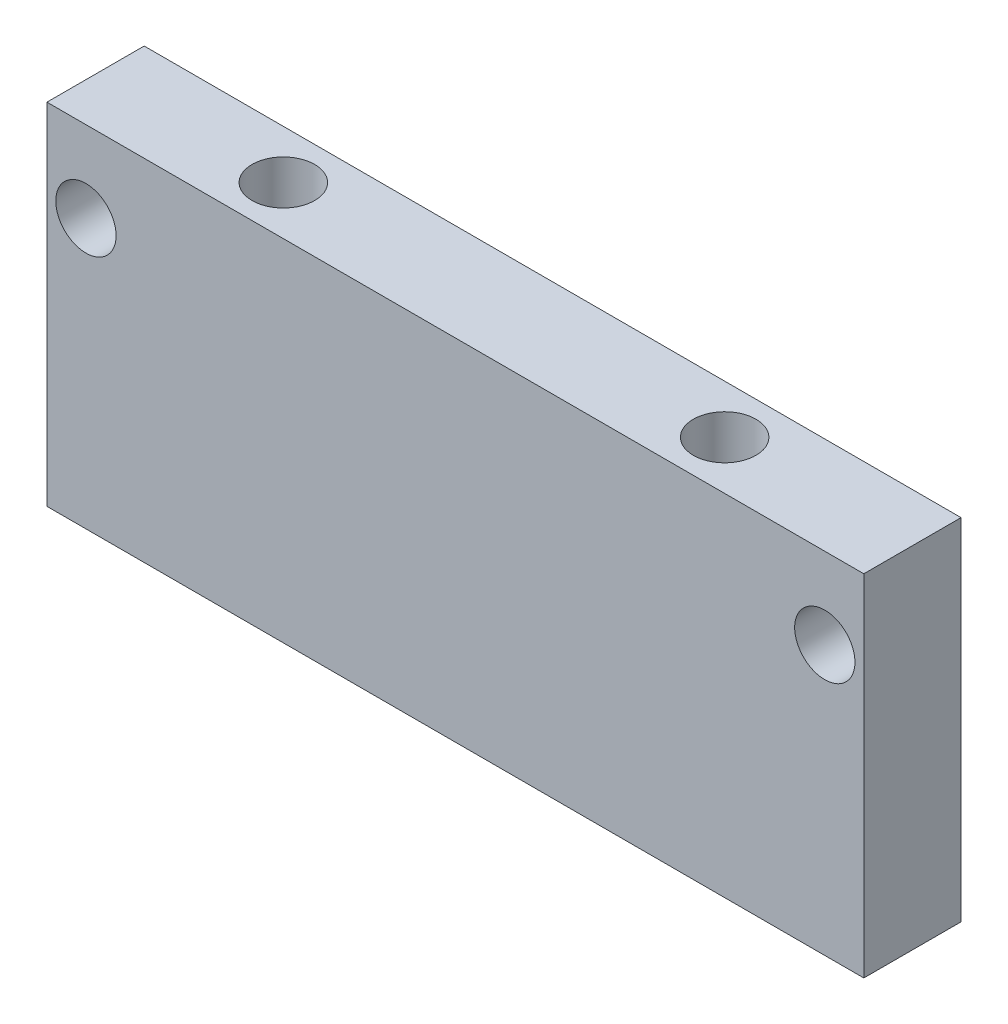
from build123d import *

# Parameters (mm, degrees)
SKETCH_1_W          = 42
SKETCH_1_H          = 5
EXTRUDE_1_DEPTH     = 18
SKETCH_2_R          = 1.55
CUT_EXTRUDE_1_DEPTH = 14.93
SKETCH_3_R          = 1.61
CUT_EXTRUDE_2_DEPTH = 28.771388154


with BuildPart() as part:
    # 草图1 → 凸台-拉伸1 (new body)
    with BuildSketch(Plane(origin=(0, 0, 0), x_dir=(1, 0, 0), z_dir=(0, 1, 0))):
        Rectangle(SKETCH_1_W, SKETCH_1_H)
    extrude(amount=EXTRUDE_1_DEPTH)

    # 草图2 → 切除-拉伸1 (cut)
    with BuildSketch(Plane.XY.offset(2.5)):
        with Locations((-18.995, 13.83)):
            Circle(SKETCH_2_R)
        with Locations((18.995, 13.83)):
            Circle(SKETCH_2_R)
    extrude(amount=-CUT_EXTRUDE_1_DEPTH, mode=Mode.SUBTRACT)

    # 草图3 → 切除-拉伸2 (cut, through all)
    with BuildSketch(Plane(origin=(0, 18, 0), x_dir=(1, 0, 0), z_dir=(0, 1, 0))):
        with Locations(Location((-11.345, 0, 0), (0, 0, 270))):
            Circle(SKETCH_3_R)
        with Locations(Location((11.345, 0, 0), (0, 0, 270))):
            Circle(SKETCH_3_R)
    extrude(amount=-CUT_EXTRUDE_2_DEPTH, mode=Mode.SUBTRACT)


solid = part.part
